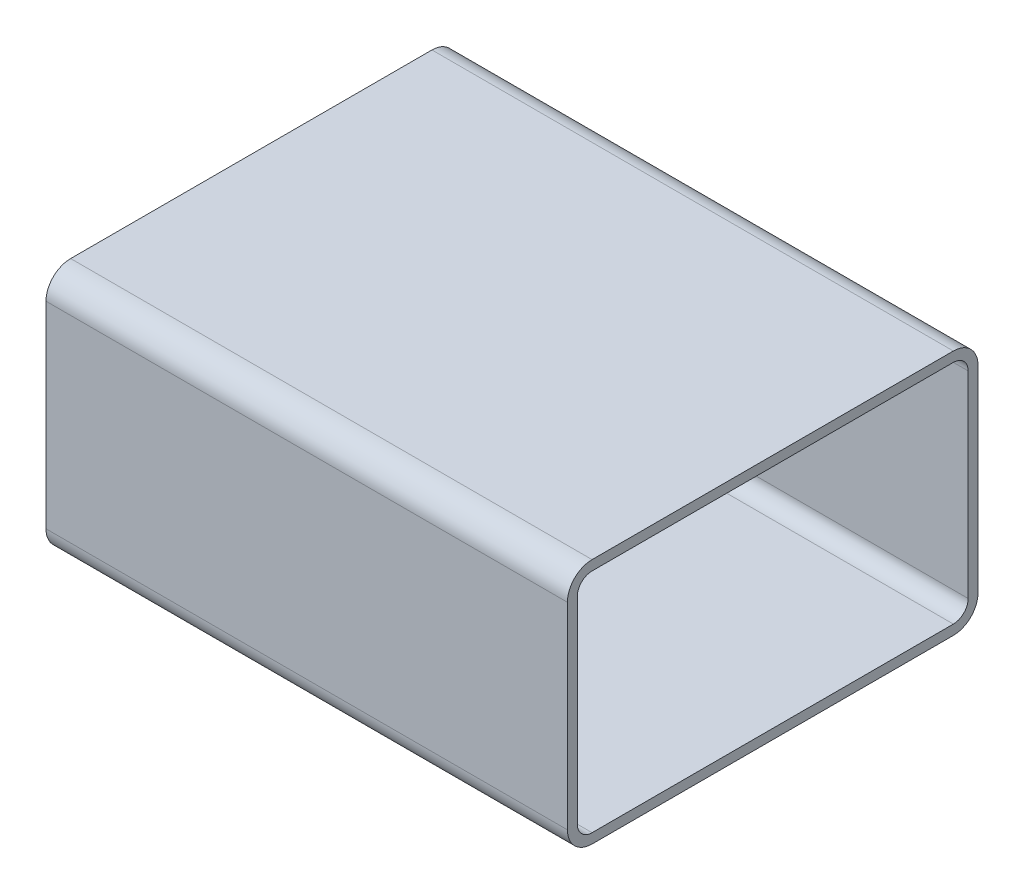
from build123d import *

# Parameters (mm, degrees)
TUBO_RETANGULAR_50_X_30_X_2_6_1_DEPTH = 63.5


with BuildPart() as part:
    # Sketch1 → Tubo retangular 50 X 30 X 2.6(1) (new body)
    with BuildSketch(Plane.YZ):
        with BuildLine():
            Line((-12, -25), (12, -25))
            ThreePointArc((12, -25), (14.121320344, -24.121320344), (15, -22))
            Line((15, -22), (15, 22))
            ThreePointArc((15, 22), (14.121320344, 24.121320344), (12, 25))
            Line((12, 25), (-12, 25))
            ThreePointArc((-12, 25), (-14.121320344, 24.121320344), (-15, 22))
            Line((-15, 22), (-15, -22))
            ThreePointArc((-15, -22), (-14.121320344, -24.121320344), (-12, -25))
        make_face()
        with BuildLine():
            Line((-12, -23.8), (12, -23.8))
            ThreePointArc((12, -23.8), (13.272792206, -23.272792206), (13.8, -22))
            Line((13.8, -22), (13.8, 22))
            ThreePointArc((13.8, 22), (13.272792206, 23.272792206), (12, 23.8))
            Line((12, 23.8), (-12, 23.8))
            ThreePointArc((-12, 23.8), (-13.272792206, 23.272792206), (-13.8, 22))
            Line((-13.8, 22), (-13.8, -22))
            ThreePointArc((-13.8, -22), (-13.272792206, -23.272792206), (-12, -23.8))
        make_face(mode=Mode.SUBTRACT)
    extrude(amount=TUBO_RETANGULAR_50_X_30_X_2_6_1_DEPTH)


solid = part.part
